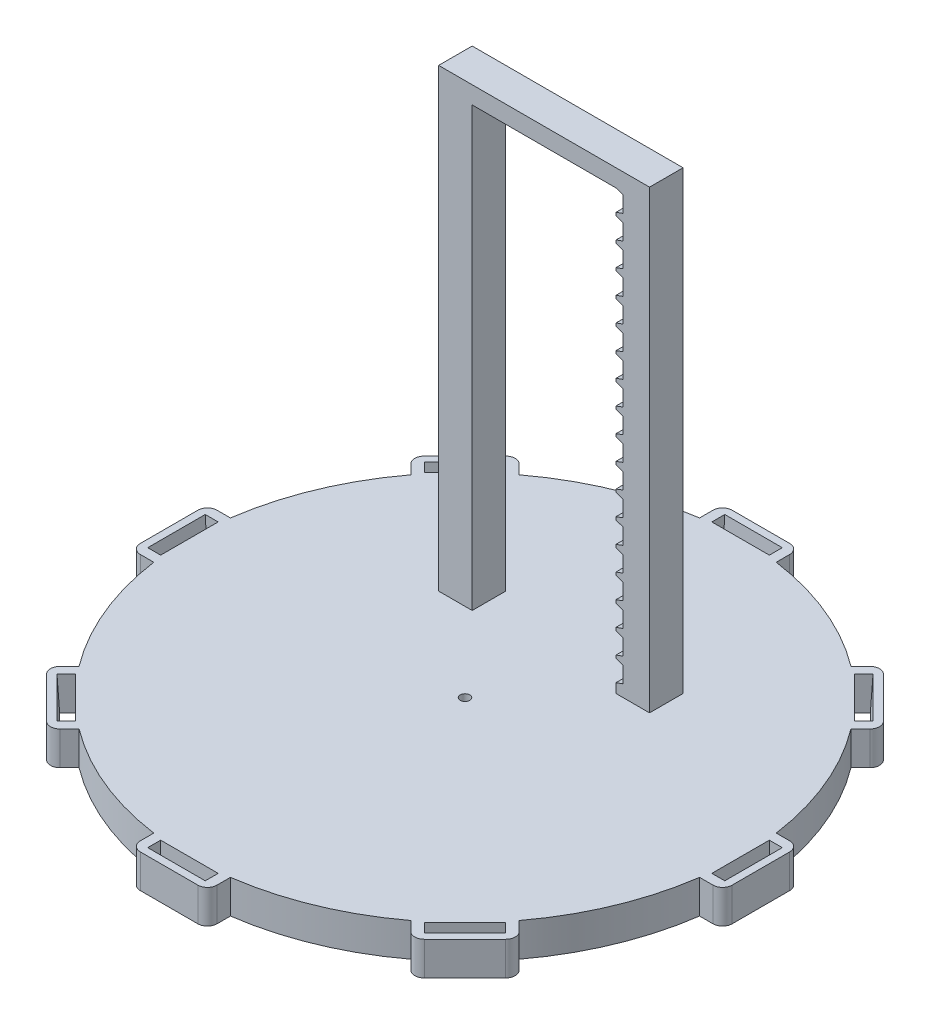
from build123d import *

# Parameters (mm, degrees)
BOSS_EXTRUDE1_DEPTH = 7
SKETCH2_W           = 7
SKETCH2_H           = 7
BOSS_EXTRUDE2_DEPTH = 95
SKETCH15_R          = 1
CUT_EXTRUDE3_DEPTH  = 7
CIRPATTERN1_COUNT   = 8
CUT_EXTRUDE5_DEPTH  = 10
LPATTERN1_COUNT     = 18
LPATTERN1_PITCH     = 5
SKETCH20_W          = 7
SKETCH20_H          = 3.645955351
BOSS_EXTRUDE3_DEPTH = 30


with BuildPart() as part:
    # Sketch1 → Boss-Extrude1 (new body)
    with BuildSketch(Plane(origin=(0, 0, 0), x_dir=(1, 0, 0), z_dir=(0, 1, 0))):
        with BuildLine():
            Line((-8, 56.940758688), (-8, 59.740758688))
            ThreePointArc((-8, 59.740758688), (-7.414213562, 61.154972251), (-6, 61.740758688))
            Line((-6, 61.740758688), (6, 61.740758688))
            ThreePointArc((6, 61.740758688), (7.414213562, 61.154972251), (8, 59.740758688))
            Line((8, 59.740758688), (8, 56.940758688))
            ThreePointArc((8, 56.940758688), (22.004297361, 53.123073119), (34.606342345, 45.920050844))
            Line((34.606342345, 45.920050844), (36.586241332, 47.899949831))
            ThreePointArc((36.586241332, 47.899949831), (38.000454895, 48.485736269), (39.414668457, 47.899949831))
            Line((39.414668457, 47.899949831), (47.899949831, 39.414668457))
            ThreePointArc((47.899949831, 39.414668457), (48.485736269, 38.000454895), (47.899949831, 36.586241332))
            Line((47.899949831, 36.586241332), (45.920050844, 34.606342345))
            ThreePointArc((45.920050844, 34.606342345), (53.123073119, 22.004297361), (56.940758688, 8))
            Line((56.940758688, 8), (59.740758688, 8))
            ThreePointArc((59.740758688, 8), (61.154972251, 7.414213562), (61.740758688, 6))
            Line((61.740758688, 6), (61.740758688, -6))
            ThreePointArc((61.740758688, -6), (61.154972251, -7.414213562), (59.740758688, -8))
            Line((59.740758688, -8), (56.940758688, -8))
            ThreePointArc((56.940758688, -8), (53.123073119, -22.004297361), (45.920050844, -34.606342345))
            Line((45.920050844, -34.606342345), (47.899949831, -36.586241332))
            ThreePointArc((47.899949831, -36.586241332), (48.485736269, -38.000454895), (47.899949831, -39.414668457))
            Line((47.899949831, -39.414668457), (39.414668457, -47.899949831))
            ThreePointArc((39.414668457, -47.899949831), (38.000454895, -48.485736269), (36.586241332, -47.899949831))
            Line((36.586241332, -47.899949831), (34.606342345, -45.920050844))
            ThreePointArc((34.606342345, -45.920050844), (22.004297361, -53.123073119), (8, -56.940758688))
            Line((8, -56.940758688), (8, -59.740758688))
            ThreePointArc((8, -59.740758688), (7.414213562, -61.154972251), (6, -61.740758688))
            Line((6, -61.740758688), (-6, -61.740758688))
            ThreePointArc((-6, -61.740758688), (-7.414213562, -61.154972251), (-8, -59.740758688))
            Line((-8, -59.740758688), (-8, -56.940758688))
            ThreePointArc((-8, -56.940758688), (-22.004297361, -53.123073119), (-34.606342345, -45.920050844))
            Line((-34.606342345, -45.920050844), (-36.586241332, -47.899949831))
            ThreePointArc((-36.586241332, -47.899949831), (-38.000454895, -48.485736269), (-39.414668457, -47.899949831))
            Line((-39.414668457, -47.899949831), (-47.899949831, -39.414668457))
            ThreePointArc((-47.899949831, -39.414668457), (-48.485736269, -38.000454895), (-47.899949831, -36.586241332))
            Line((-47.899949831, -36.586241332), (-45.920050844, -34.606342345))
            ThreePointArc((-45.920050844, -34.606342345), (-53.123073119, -22.004297361), (-56.940758688, -8))
            Line((-56.940758688, -8), (-59.740758688, -8))
            ThreePointArc((-59.740758688, -8), (-61.154972251, -7.414213562), (-61.740758688, -6))
            Line((-61.740758688, -6), (-61.740758688, 6))
            ThreePointArc((-61.740758688, 6), (-61.154972251, 7.414213562), (-59.740758688, 8))
            Line((-59.740758688, 8), (-56.940758688, 8))
            ThreePointArc((-56.940758688, 8), (-53.123073119, 22.004297361), (-45.920050844, 34.606342345))
            Line((-45.920050844, 34.606342345), (-47.899949831, 36.586241332))
            ThreePointArc((-47.899949831, 36.586241332), (-48.485736269, 38.000454895), (-47.899949831, 39.414668457))
            Line((-47.899949831, 39.414668457), (-39.414668457, 47.899949831))
            ThreePointArc((-39.414668457, 47.899949831), (-38.000454895, 48.485736269), (-36.586241332, 47.899949831))
            Line((-36.586241332, 47.899949831), (-34.606342345, 45.920050844))
            ThreePointArc((-34.606342345, 45.920050844), (-22.004297361, 53.123073119), (-8, 56.940758688))
        make_face()
    extrude(amount=BOSS_EXTRUDE1_DEPTH)

    # Sketch2 → Boss-Extrude2 (add)
    with BuildSketch(Plane(origin=(0, 7, 0), x_dir=(1, 0, 0), z_dir=(0, 1, 0))):
        with Locations((18.5, 20)):
            Rectangle(SKETCH2_W, SKETCH2_H)
        with Locations((-18.5, 20)):
            Rectangle(SKETCH2_W, SKETCH2_H)
    extrude(amount=BOSS_EXTRUDE2_DEPTH)

    # Sketch15 → Cut-Extrude3 (cut)
    with BuildSketch(Plane.XZ):
        with Locations(Location((0, 0, 0), (0, 0, 270))):
            Circle(SKETCH15_R)
    extrude(amount=-CUT_EXTRUDE3_DEPTH, mode=Mode.SUBTRACT)

    # Sketch16 → Cut-Loft2 section 0
    with BuildSketch(Plane.XZ):
        with BuildLine():
            Line((-6, 59.8), (6, 59.8))
            Line((6, 59.8), (6, 57.5))
            Line((6, 57.5), (-6, 57.5))
            Line((-6, 57.5), (-6, 59.8))
        make_face()
    # Sketch17 → Cut-Loft2 section 1
    with BuildSketch(Plane(origin=(0, 7, 0), x_dir=(1, 0, 0), z_dir=(0, 1, 0))):
        with BuildLine():
            Line((-6, -57.5), (6, -57.5))
            Line((6, -57.5), (6, -60.2))
            Line((6, -60.2), (-6, -60.2))
            Line((-6, -60.2), (-6, -57.5))
        make_face()
    cut_loft2 = loft(mode=Mode.SUBTRACT)

    # CirPattern1: Cut-Loft2 ×8 about axis
    cirpattern1_axis = Axis((0, 0, 0), (0, 1, 0))
    for i in range(1, CIRPATTERN1_COUNT):
        add(cut_loft2.rotate(cirpattern1_axis, i * 360 / CIRPATTERN1_COUNT), mode=Mode.SUBTRACT)

    # Sketch19 → Cut-Extrude5 (cut)
    with BuildSketch(Plane(origin=(0, 0, -23.5), x_dir=(-1, 0, 0), z_dir=(0, 0, -1))):
        Polygon((-15, 98.354044649), (-16.5, 97.808089297), (-16.5, 96.708089297), (-16.5, 94.5), (-15, 93.954044649), align=None)
    cut_extrude5 = extrude(amount=-CUT_EXTRUDE5_DEPTH, mode=Mode.SUBTRACT)

    # LPattern1: Cut-Extrude5 ×18
    with Locations(*[(0, -i * LPATTERN1_PITCH, 0) for i in range(1, LPATTERN1_COUNT)]):
        add(cut_extrude5, mode=Mode.SUBTRACT)

    # Sketch20 → Boss-Extrude3 (add)
    with BuildSketch(Plane.ZY.offset(-15)):
        with Locations((-20, 100.177022325)):
            Rectangle(SKETCH20_W, SKETCH20_H)
    extrude(amount=BOSS_EXTRUDE3_DEPTH)


solid = part.part
